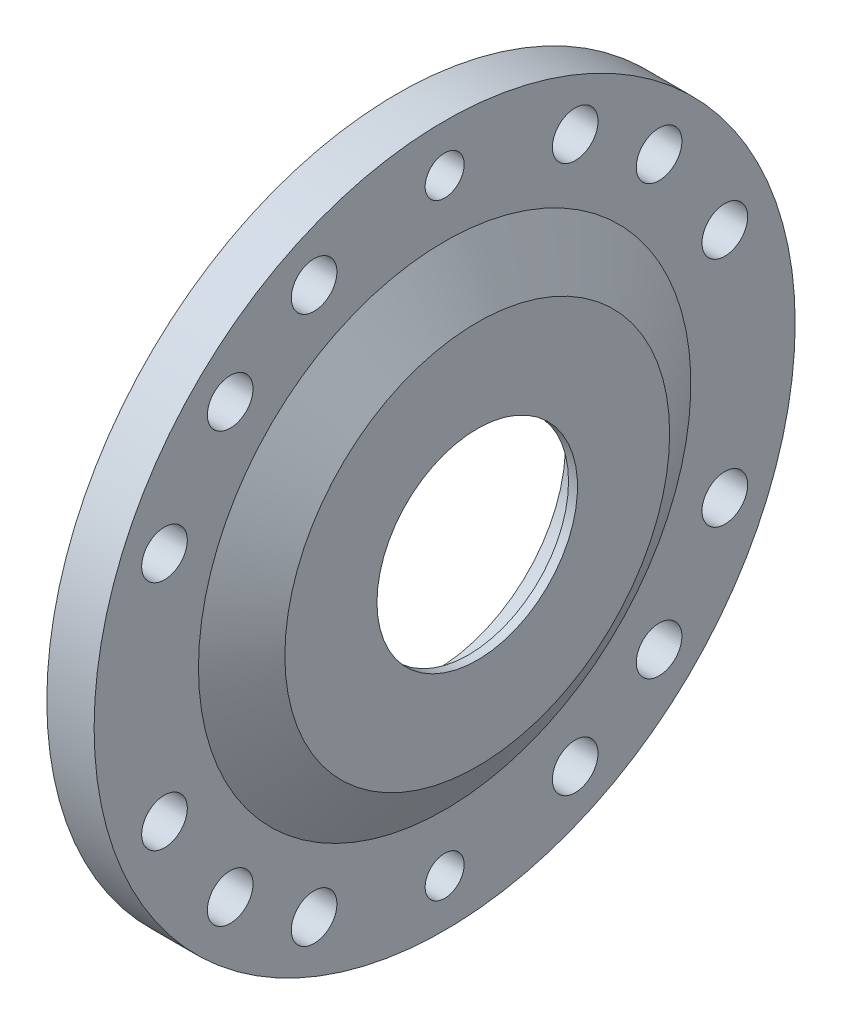
from build123d import *

# Parameters (mm, degrees)
ESQUISSE2_R             = 7
ESQUISSE2_R_2           = 5.983
ENL_V_MAT_EXTRU_1_DEPTH = 154.98944769
ESQUISSE3_R             = 30.75
ENL_V_MAT_EXTRU_2_DEPTH = 153.723114362
CONG_2_R                = 1
CONG_3_R                = 2.5


with BuildPart() as part:
    # Esquisse1 → Révolution1 (revolve)
    with BuildSketch(Plane.XY, mode=Mode.PRIVATE) as r_volution1_sk:
        Polygon((85.536385131, 40), (85.536385131, 0), (88.292789625, 0), (88.292789625, 59), (78.292789625, 75.5), (78.292789625, 107.5), (63.792789625, 107.5), (63.792789625, 70), (60.792789625, 70), (60.792789625, 61), (61.398850231, 60), (75.347845805, 60), (75.347845805, 40), align=None)
    revolve(r_volution1_sk.sketch.rotate(Axis((85.536385131, 0, 0), (1, 0, 0)), 90), axis=Axis((85.536385131, 0, 0), (1, 0, 0)))

    # Esquisse2 → Enlèv. mat.-Extru.1 (cut, through all)
    with BuildSketch(Plane.ZY.offset(-63.792789625)):
        with Locations((-40.037532003, 83.940431445)):
            Circle(ESQUISSE2_R)
        with Locations((-65.76093065, 65.76093065)):
            Circle(ESQUISSE2_R)
        with Locations((-85.920796524, 35.58955921)):
            Circle(ESQUISSE2_R)
        with Locations((40.037532003, 83.940431445)):
            Circle(ESQUISSE2_R)
        with Locations((65.76093065, 65.76093065)):
            Circle(ESQUISSE2_R)
        with Locations((85.920796524, 35.58955921)):
            Circle(ESQUISSE2_R)
        with Locations((85.920796524, -35.58955921)):
            Circle(ESQUISSE2_R)
        with Locations((65.76093065, -65.76093065)):
            Circle(ESQUISSE2_R)
        with Locations((40.037532003, -83.940431445)):
            Circle(ESQUISSE2_R)
        with Locations((-40.037532003, -83.940431445)):
            Circle(ESQUISSE2_R)
        with Locations((-65.76093065, -65.76093065)):
            Circle(ESQUISSE2_R)
        with Locations((-85.920796524, -35.58955921)):
            Circle(ESQUISSE2_R)
        with Locations((0, 93)):
            Circle(ESQUISSE2_R_2)
        with Locations((0, -93)):
            Circle(ESQUISSE2_R_2)
    extrude(amount=-ENL_V_MAT_EXTRU_1_DEPTH, mode=Mode.SUBTRACT)

    # Esquisse3 → Enlèv. mat.-Extru.2 (cut, through all)
    with BuildSketch(Plane.ZY.offset(-75.347845805)):
        Circle(ESQUISSE3_R)
    extrude(amount=-ENL_V_MAT_EXTRU_2_DEPTH, mode=Mode.SUBTRACT)

    # Congé2
    cong_2_edges = [part.edges().sort_by_distance(p)[0] for p in [
        (60.792789625, 0, -70),
    ]]
    fillet(cong_2_edges, radius=CONG_2_R)

    # Congé3
    cong_3_edges = [part.edges().sort_by_distance(p)[0] for p in [
        (75.347845805, 0, -60),
    ]]
    fillet(cong_3_edges, radius=CONG_3_R)


solid = part.part
